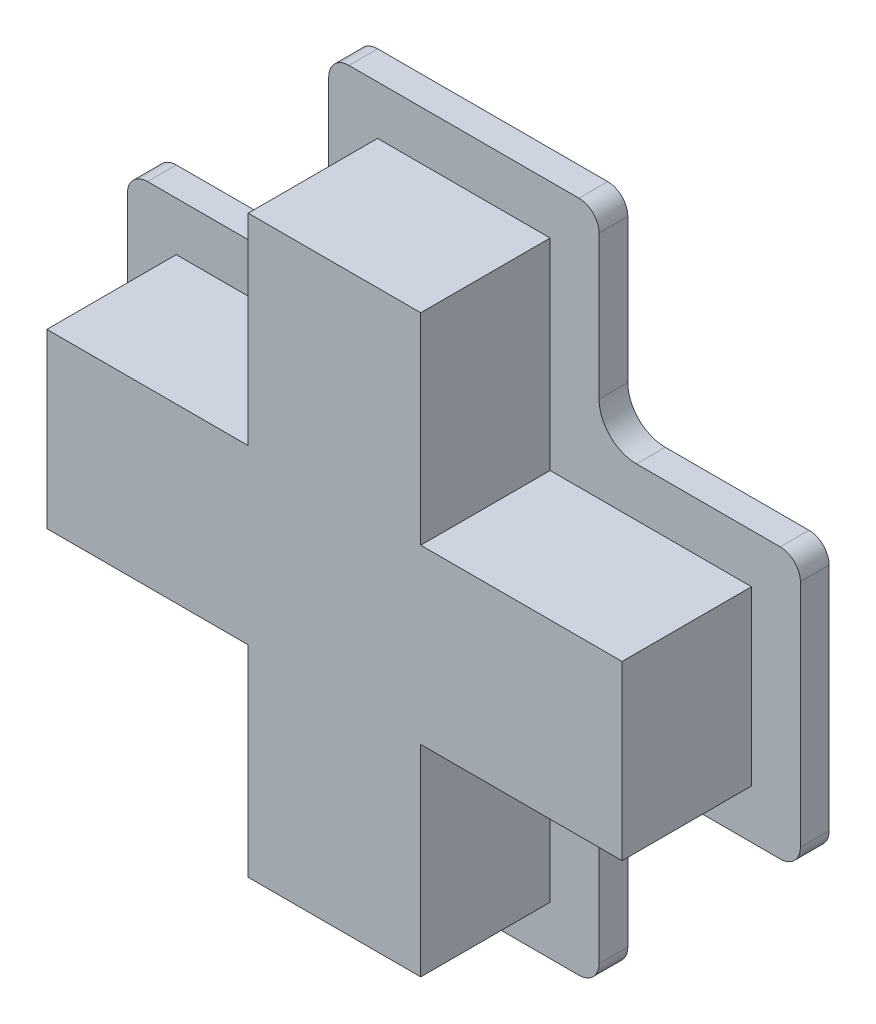
from build123d import *

# Parameters (mm, degrees)
BOSS_EXTRUDE1_DEPTH = 5.5
BOSS_EXTRUDE2_DEPTH = 1


with BuildPart() as part:
    # Sketch1 → Boss-Extrude1 (new body)
    with BuildSketch(Plane.XY):
        Polygon((-14.173922558, 7.032133424), (-14.173922558, 1.032133424), (-7.173922558, 1.032133424), (-7.173922558, -5.967866576), (-1.173922558, -5.967866576), (-1.173922558, 1.032133424), (5.826077442, 1.032133424), (5.826077442, 7.032133424), (-1.173922558, 7.032133424), (-1.173922558, 14.032133424), (-7.173922558, 14.032133424), (-7.173922558, 7.032133424), align=None)
    extrude(amount=BOSS_EXTRUDE1_DEPTH)

    # Sketch2 → Boss-Extrude2 (add)
    with BuildSketch(Plane.XY):
        with BuildLine():
            Line((-15.873922558, 8.032133424), (-15.873922558, 0.032133424))
            ThreePointArc((-15.873922558, 0.032133424), (-15.668897304, -0.462841323), (-15.173922558, -0.667866576))
            Line((-15.173922558, -0.667866576), (-10.173922558, -0.667866576))
            ThreePointArc((-10.173922558, -0.667866576), (-9.254683742, -1.048627761), (-8.873922558, -1.967866576))
            Line((-8.873922558, -1.967866576), (-8.873922558, -6.967866576))
            ThreePointArc((-8.873922558, -6.967866576), (-8.668897304, -7.462841323), (-8.173922558, -7.667866576))
            Line((-8.173922558, -7.667866576), (-0.173922558, -7.667866576))
            ThreePointArc((-0.173922558, -7.667866576), (0.321052189, -7.462841323), (0.526077442, -6.967866576))
            Line((0.526077442, -6.967866576), (0.526077442, -1.967866576))
            ThreePointArc((0.526077442, -1.967866576), (0.906838627, -1.048627761), (1.826077442, -0.667866576))
            Line((1.826077442, -0.667866576), (6.826077442, -0.667866576))
            ThreePointArc((6.826077442, -0.667866576), (7.321052189, -0.462841323), (7.526077442, 0.032133424))
            Line((7.526077442, 0.032133424), (7.526077442, 8.032133424))
            ThreePointArc((7.526077442, 8.032133424), (7.321052189, 8.527108171), (6.826077442, 8.732133424))
            Line((6.826077442, 8.732133424), (1.826077442, 8.732133424))
            ThreePointArc((1.826077442, 8.732133424), (0.906838627, 9.112894608), (0.526077442, 10.032133424))
            Line((0.526077442, 10.032133424), (0.526077442, 15.032133424))
            ThreePointArc((0.526077442, 15.032133424), (0.321052189, 15.527108171), (-0.173922558, 15.732133424))
            Line((-0.173922558, 15.732133424), (-8.173922558, 15.732133424))
            ThreePointArc((-8.173922558, 15.732133424), (-8.668897304, 15.527108171), (-8.873922558, 15.032133424))
            Line((-8.873922558, 15.032133424), (-8.873922558, 10.032133424))
            ThreePointArc((-8.873922558, 10.032133424), (-9.254683742, 9.112894608), (-10.173922558, 8.732133424))
            Line((-10.173922558, 8.732133424), (-15.173922558, 8.732133424))
            ThreePointArc((-15.173922558, 8.732133424), (-15.668897304, 8.527108171), (-15.873922558, 8.032133424))
        make_face()
    extrude(amount=BOSS_EXTRUDE2_DEPTH)


solid = part.part
